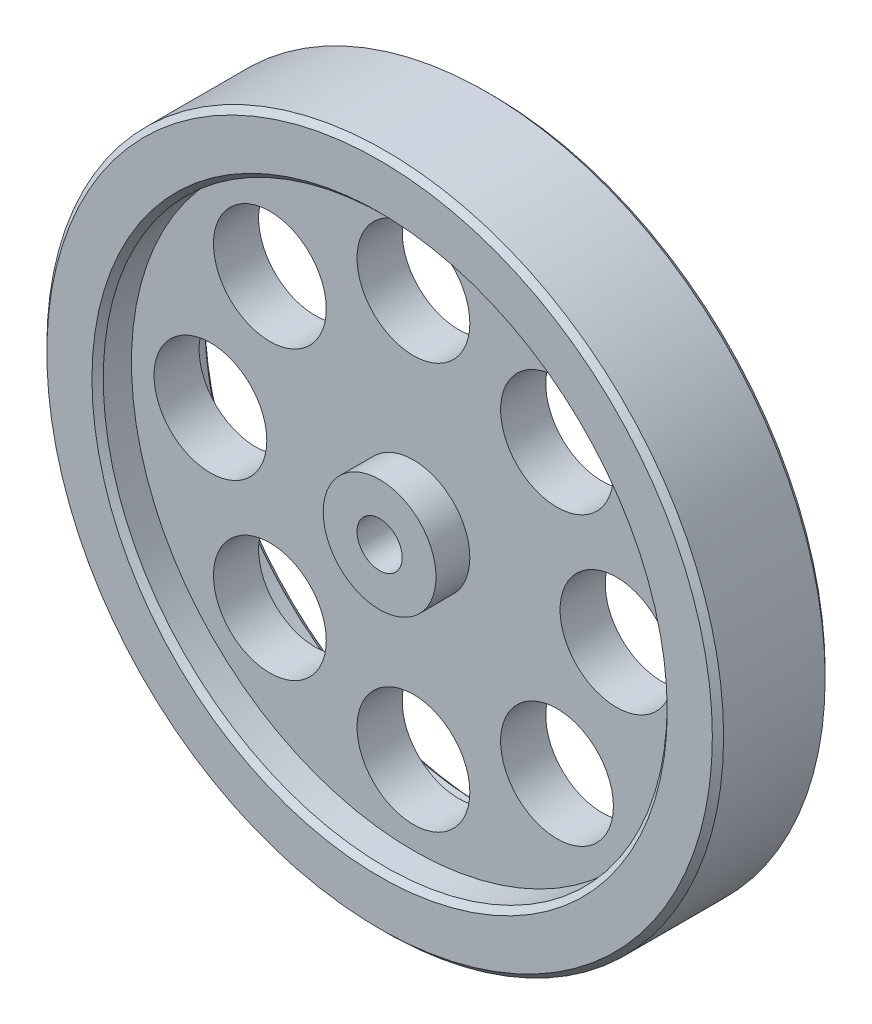
from build123d import *

# Parameters (mm, degrees)
SKETCH1_R                = 30
SKETCH1_R_2              = 25
BOSS_EXTRUDE1_DEPTH      = 5
SKETCH2_R                = 25
BOSS_EXTRUDE2_DEPTH      = 2
CUT_EXTRUDE1_DEPTH       = 43.720018727
CUT_EXTRUDE1_DEPTH_BACK  = 43.720018727
SKETCH2_4_R              = 5
BOSS_EXTRUDE3_DEPTH      = 3
BOSS_EXTRUDE3_DEPTH_BACK = 7
SKETCH3_R                = 5
SKETCH3_R_2              = 2
CUT_EXTRUDE2_DEPTH       = 44
CUT_EXTRUDE2_DEPTH_BACK  = 44
SKETCH4_R                = 5
CHAMFER1_SIZE            = 0.5


with BuildPart() as part:
    # Sketch1 → Boss-Extrude1 (new, symmetric)
    with BuildSketch(Plane.XY):
        Circle(SKETCH1_R)
        Circle(SKETCH1_R_2, mode=Mode.SUBTRACT)
    extrude(amount=BOSS_EXTRUDE1_DEPTH, both=True)

    # Sketch2 → Boss-Extrude2 (add, symmetric)
    with BuildSketch(Plane.XY):
        Circle(SKETCH2_R)
    extrude(amount=BOSS_EXTRUDE2_DEPTH, both=True)

    # Sketch2<4> → Cut-Extrude1 (cut, two sides: drawn at the far end of the back side and taken through both)
    with BuildSketch(Plane.XY.offset(-CUT_EXTRUDE1_DEPTH_BACK)):
        Circle(SKETCH2_4_R)
    extrude(amount=CUT_EXTRUDE1_DEPTH + CUT_EXTRUDE1_DEPTH_BACK, mode=Mode.SUBTRACT)

    # Sketch3 → Boss-Extrude3 (add, two sides: drawn at the far end of the back side and taken through both)
    with BuildSketch(Plane(origin=(0, 0, -2), x_dir=(-1, 0, 0), z_dir=(0, 0, -1)).offset(-BOSS_EXTRUDE3_DEPTH_BACK)):
        Circle(SKETCH3_R)
        Circle(SKETCH3_R_2, mode=Mode.SUBTRACT)
    extrude(amount=BOSS_EXTRUDE3_DEPTH + BOSS_EXTRUDE3_DEPTH_BACK)

    # Sketch4 → Cut-Extrude2 (cut, two sides: drawn at the far end of the back side and taken through both)
    with BuildSketch(Plane(origin=(0, 0, -2), x_dir=(-1, 0, 0), z_dir=(0, 0, -1)).offset(-CUT_EXTRUDE2_DEPTH_BACK)):
        with Locations((0, 18)):
            Circle(SKETCH4_R)
        with Locations((12.727922061, 12.727922061)):
            Circle(SKETCH4_R)
        with Locations((18, 0)):
            Circle(SKETCH4_R)
        with Locations((12.727922061, -12.727922061)):
            Circle(SKETCH4_R)
        with Locations((0, -18)):
            Circle(SKETCH4_R)
        with Locations((-12.727922061, -12.727922061)):
            Circle(SKETCH4_R)
        with Locations((-18, 0)):
            Circle(SKETCH4_R)
        with Locations((-12.727922061, 12.727922061)):
            Circle(SKETCH4_R)
    extrude(amount=CUT_EXTRUDE2_DEPTH + CUT_EXTRUDE2_DEPTH_BACK, mode=Mode.SUBTRACT)

    # Chamfer1
    chamfer1_edges = [part.edges().sort_by_distance(p)[0] for p in [
        (-25, 0, 5),
        (-30, 0, 5),
        (-25, 0, -5),
        (-30, 0, -5),
    ]]
    chamfer(chamfer1_edges, length=CHAMFER1_SIZE)


solid = part.part
